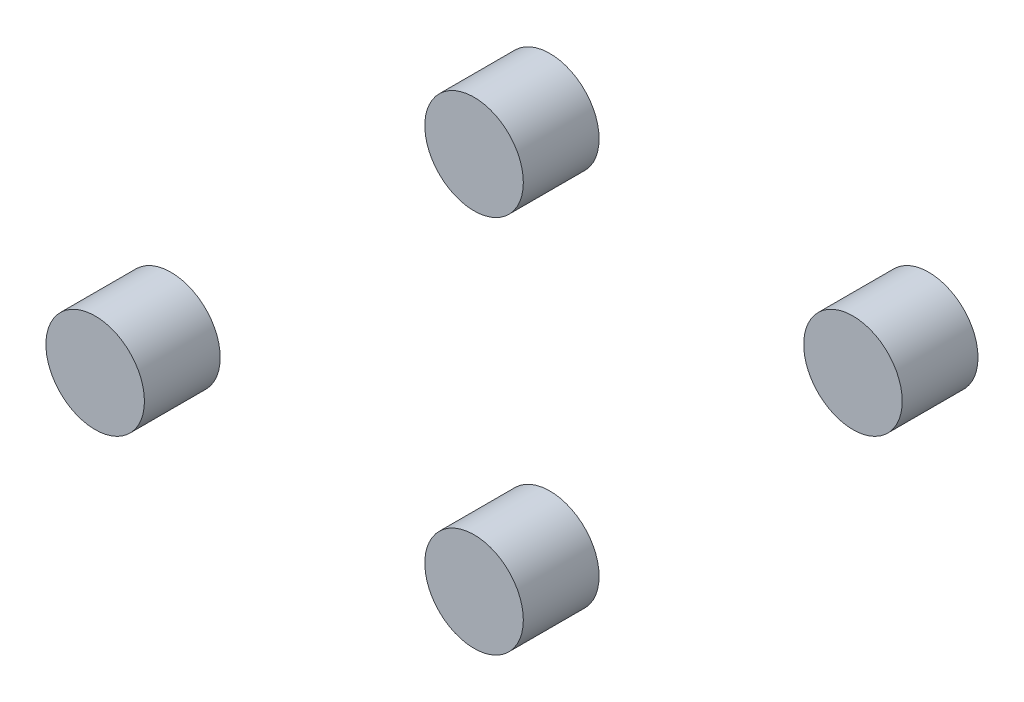
from build123d import *

# Parameters (mm, degrees)
BOSS_EXTRUDE1_START   = 228.6
SKETCH1_R             = 49.53
BOSS_EXTRUDE1_DEPTH   = 76.2
BOSS_EXTRUDE1_2_DEPTH = 76.2


with BuildPart() as part:
    # Sketch1 → Boss-Extrude1 (new body)
    with BuildSketch(Plane.XY.offset(BOSS_EXTRUDE1_START)):
        Circle(SKETCH1_R)
    extrude(amount=-BOSS_EXTRUDE1_DEPTH)


with BuildPart() as body_2:
    # Sketch1 → Boss-Extrude1 2 (new body)
    with BuildSketch(Plane.XY.offset(BOSS_EXTRUDE1_START)):
        with Locations((381, 0)):
            Circle(SKETCH1_R)
    extrude(amount=-BOSS_EXTRUDE1_2_DEPTH)


with BuildPart() as body_3:
    # Mirror3: mirrored copy
    add(part.part.mirror(Plane.XY))


with BuildPart() as body_4:
    # Mirror3 2: mirrored copy
    add(body_2.part.mirror(Plane.XY))


solid = Compound([part.part, body_2.part, body_3.part, body_4.part])
